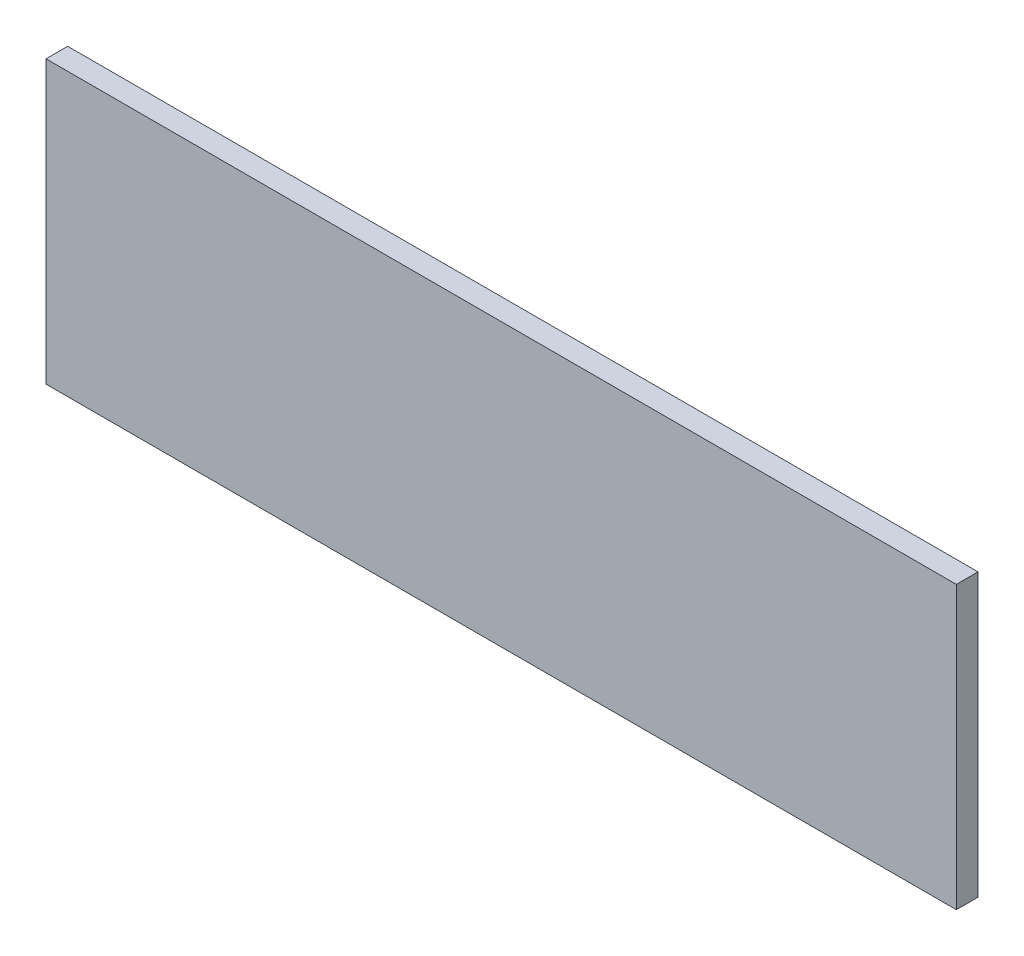
from build123d import *

# Parameters (mm, degrees)
SKETCH1_W           = 210
SKETCH1_H           = 65
BOSS_EXTRUDE1_DEPTH = 5


with BuildPart() as part:
    # Sketch1 → Boss-Extrude1 (new body)
    with BuildSketch(Plane.XY):
        with Locations((-5, 14.256756757)):
            Rectangle(SKETCH1_W, SKETCH1_H)
    extrude(amount=BOSS_EXTRUDE1_DEPTH)


solid = part.part
